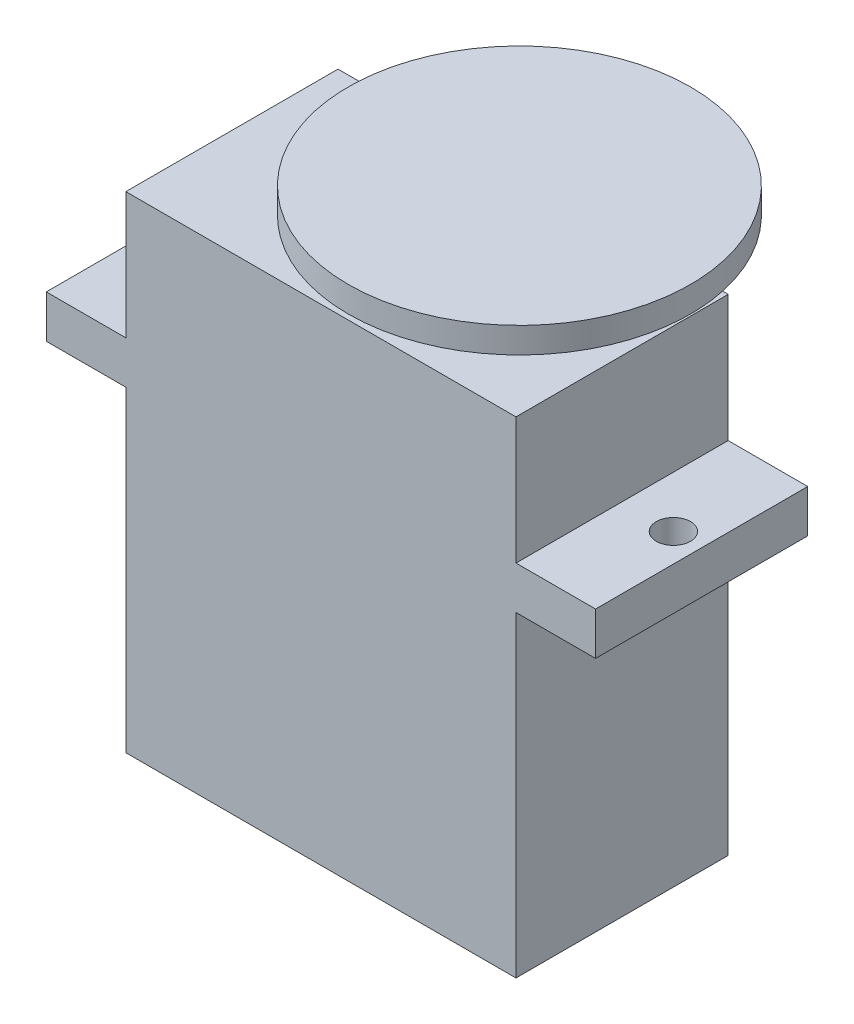
from build123d import *

# Parameters (mm, degrees)
SKETCH2_W           = 32.1
SKETCH2_H           = 12.4
BOSS_EXTRUDE1_DEPTH = 2.5
SKETCH3_W           = 22.8
SKETCH3_H           = 12.4
BOSS_EXTRUDE2_DEPTH = 18.5
SKETCH4_W           = 22.8
SKETCH4_H           = 12.4
BOSS_EXTRUDE3_DEPTH = 7.4
SKETCH5_R           = 2.5
BOSS_EXTRUDE4_DEPTH = 4.1
SKETCH6_R           = 1
CUT_EXTRUDE1_DEPTH  = 28.148526664
SKETCH7_R           = 10
BOSS_EXTRUDE5_DEPTH = 1.5


with BuildPart() as part:
    # Sketch2 → Boss-Extrude1 (new body)
    with BuildSketch(Plane(origin=(0, 0, 0), x_dir=(1, 0, 0), z_dir=(0, 1, 0))):
        Rectangle(SKETCH2_W, SKETCH2_H)
    extrude(amount=BOSS_EXTRUDE1_DEPTH)

    # Sketch3 → Boss-Extrude2 (add)
    with BuildSketch(Plane(origin=(0, 0, 0), x_dir=(-1, 0, 0), z_dir=(0, -1, 0))):
        Rectangle(SKETCH3_W, SKETCH3_H)
    extrude(amount=BOSS_EXTRUDE2_DEPTH)

    # Sketch4 → Boss-Extrude3 (add)
    with BuildSketch(Plane(origin=(0, 2.5, 0), x_dir=(1, 0, 0), z_dir=(0, 1, 0))):
        Rectangle(SKETCH4_W, SKETCH4_H)
    extrude(amount=BOSS_EXTRUDE3_DEPTH)

    # Sketch5 → Boss-Extrude4 (add)
    with BuildSketch(Plane(origin=(0, 9.9, 0), x_dir=(1, 0, 0), z_dir=(0, 1, 0))):
        with Locations(Location((5.4, 0, 0), (0, 0, 90))):
            Circle(SKETCH5_R)
    extrude(amount=BOSS_EXTRUDE4_DEPTH)

    # Sketch6 → Cut-Extrude1 (cut, through all)
    with BuildSketch(Plane(origin=(0, 2.5, 0), x_dir=(1, 0, 0), z_dir=(0, 1, 0))):
        with Locations(Location((-14.4, 0, 0), (0, 0, 270))):
            Circle(SKETCH6_R)
        with Locations(Location((14.4, 0, 0), (0, 0, 90))):
            Circle(SKETCH6_R)
    extrude(amount=-CUT_EXTRUDE1_DEPTH, mode=Mode.SUBTRACT)

    # Sketch7 → Boss-Extrude5 (add)
    with BuildSketch(Plane(origin=(0, 14, 0), x_dir=(1, 0, 0), z_dir=(0, 1, 0))):
        with Locations(Location((5.4, 0, 0), (0, 0, 270))):
            Circle(SKETCH7_R)
    extrude(amount=BOSS_EXTRUDE5_DEPTH)


solid = part.part
